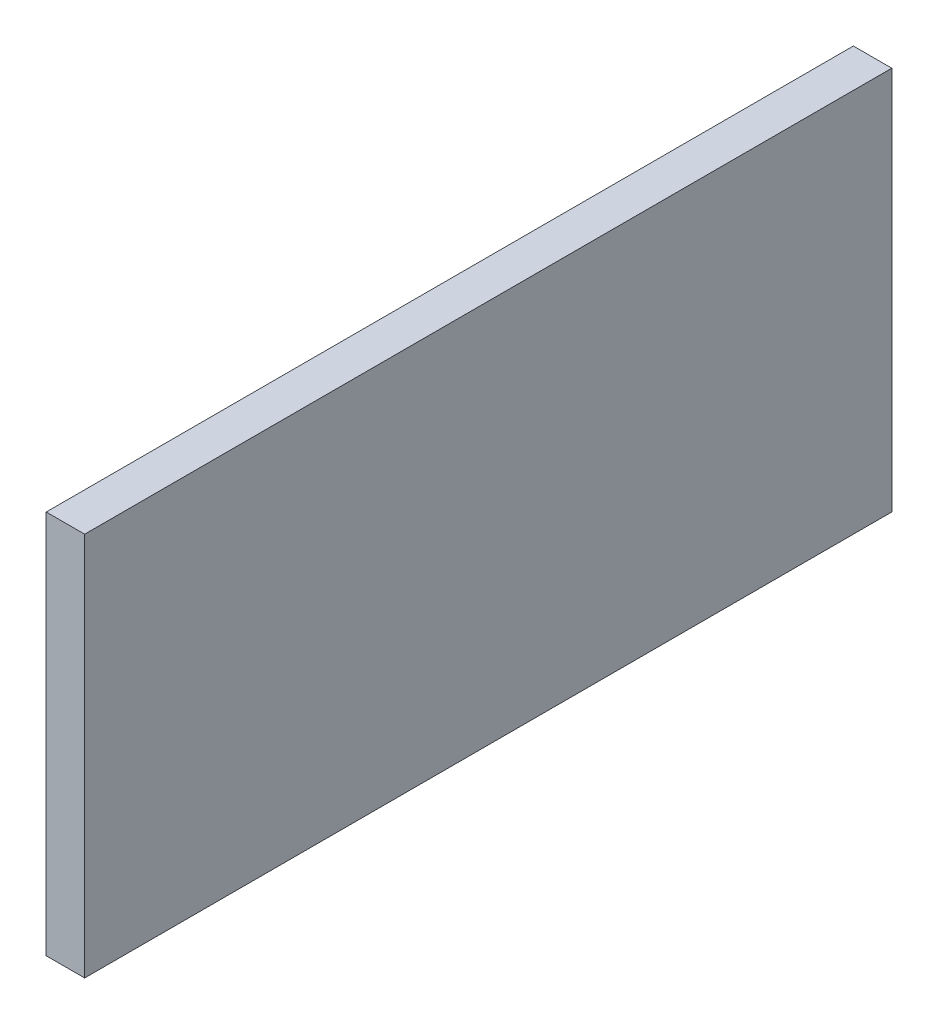
from build123d import *

# Parameters (mm, degrees)
SKETCH1_W           = 200
SKETCH1_H           = 4200
BOSS_EXTRUDE1_DEPTH = 2000


with BuildPart() as part:
    # Sketch1 → Boss-Extrude1 (new body)
    with BuildSketch(Plane(origin=(0, 0, 0), x_dir=(1, 0, 0), z_dir=(0, 1, 0))):
        Rectangle(SKETCH1_W, SKETCH1_H)
    extrude(amount=BOSS_EXTRUDE1_DEPTH)


solid = part.part
